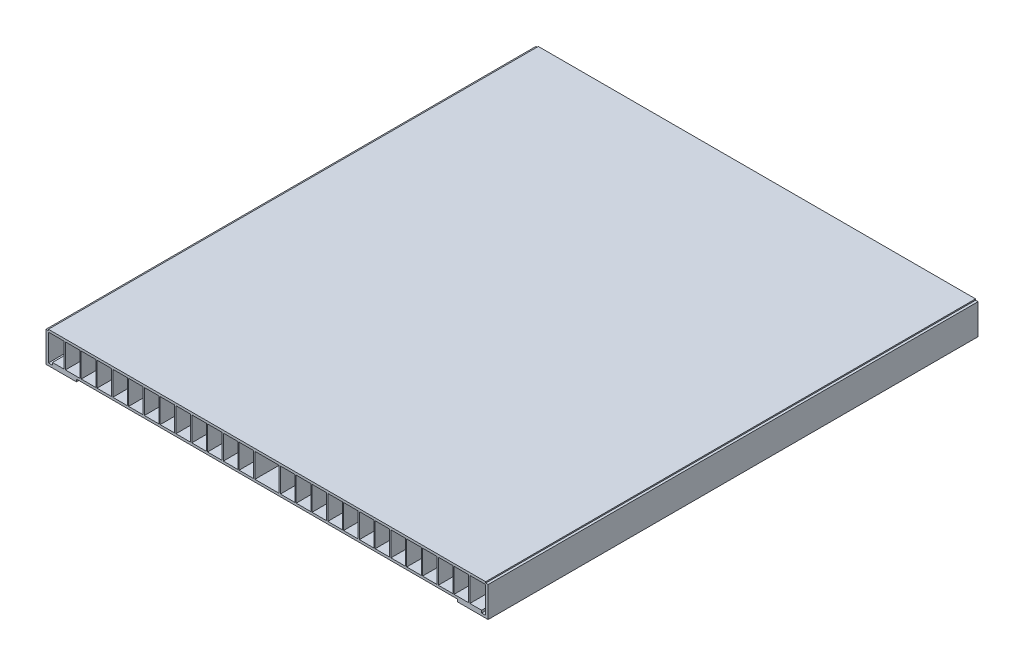
from build123d import *

# Parameters (mm, degrees)
SKETCH_1_W      = 36
SKETCH_1_H      = 60
EXTRUDE_1_DEPTH = 1210


with BuildPart() as part:
    # Эскиз1 → Вытянуть1 (new body)
    with BuildSketch(Plane.XY):
        Polygon((0, 75), (0, 0), (75, 0), (75, 6), (546, 6), (546, 12), (516, 12), (516, 72), (546, 72), (546, 78), (6, 78), (6, 75), align=None)
        with Locations((495, 42)):
            Rectangle(SKETCH_1_W, SKETCH_1_H, mode=Mode.SUBTRACT)
        with Locations((456, 42)):
            Rectangle(SKETCH_1_W, SKETCH_1_H, mode=Mode.SUBTRACT)
        with Locations((417, 42)):
            Rectangle(SKETCH_1_W, SKETCH_1_H, mode=Mode.SUBTRACT)
        with Locations((378, 42)):
            Rectangle(SKETCH_1_W, SKETCH_1_H, mode=Mode.SUBTRACT)
        with Locations((339, 42)):
            Rectangle(SKETCH_1_W, SKETCH_1_H, mode=Mode.SUBTRACT)
        with Locations((300, 42)):
            Rectangle(SKETCH_1_W, SKETCH_1_H, mode=Mode.SUBTRACT)
        with Locations((261, 42)):
            Rectangle(SKETCH_1_W, SKETCH_1_H, mode=Mode.SUBTRACT)
        with Locations((222, 42)):
            Rectangle(SKETCH_1_W, SKETCH_1_H, mode=Mode.SUBTRACT)
        with Locations((183, 42)):
            Rectangle(SKETCH_1_W, SKETCH_1_H, mode=Mode.SUBTRACT)
        with Locations((144, 42)):
            Rectangle(SKETCH_1_W, SKETCH_1_H, mode=Mode.SUBTRACT)
        with Locations((105, 42)):
            Rectangle(SKETCH_1_W, SKETCH_1_H, mode=Mode.SUBTRACT)
        with Locations((66, 42)):
            Rectangle(SKETCH_1_W, SKETCH_1_H, mode=Mode.SUBTRACT)
        Polygon((45, 12), (16, 12), (16, 6), (6, 6), (6, 72), (45, 72), align=None, mode=Mode.SUBTRACT)
    extrude(amount=-EXTRUDE_1_DEPTH)

    # Зеркальное отражение1: part across face


with BuildPart() as part_1:
    add(part.part)
    add(part.part.mirror(Plane(origin=(546, 9, -605), x_dir=(0, 0, 1), z_dir=(1, 0, 0))))


solid = part_1.part
